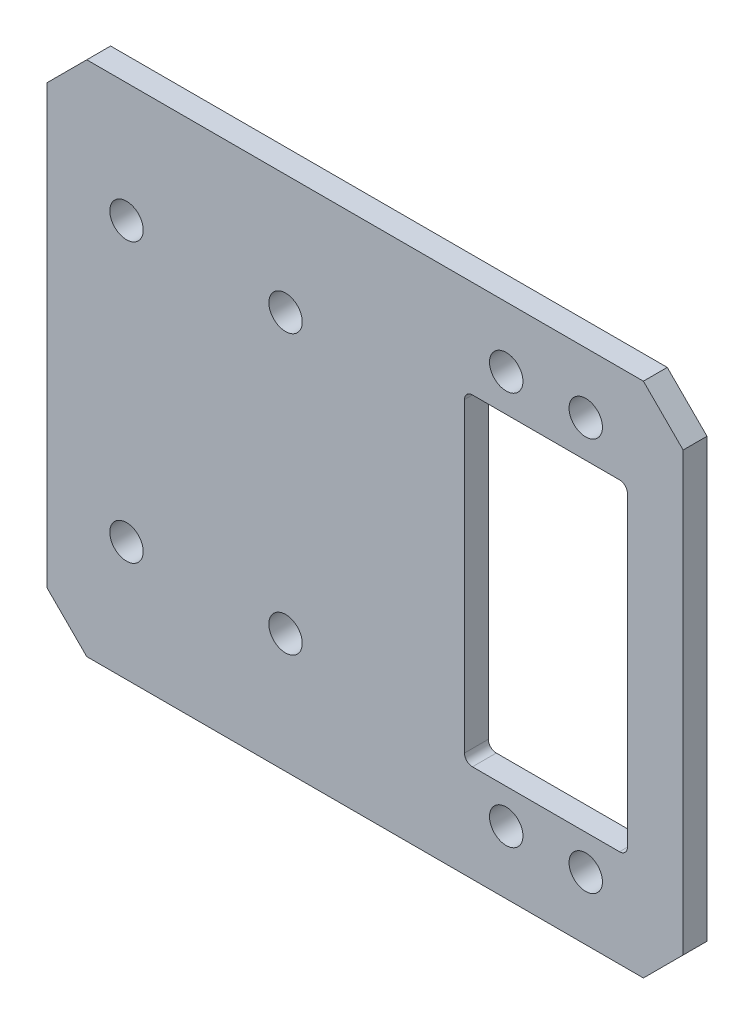
from build123d import *

# Parameters (mm, degrees)
SKETCH_1_W                  = 80
SKETCH_1_H                  = 65
EXTRUDE_1_DEPTH             = 3
SKETCH_2_R                  = 2.1
CUT_EXTRUDE_1_DEPTH         = 52.626059311
PATTERN_LINEAR_1_COUNT      = 2
PATTERN_LINEAR_1_PITCH      = 20
PATTERN_LINEAR_1_COUNT_DIR2 = 2
PATTERN_LINEAR_1_PITCH_DIR2 = 35
SKETCH_4_W                  = 20.5
SKETCH_4_H                  = 40.5
CUT_EXTRUDE_2_DEPTH         = 3
FILLET_1_R                  = 1
CUT_EXTRUDE_3_REACH         = 53.626
SKETCH_5_R                  = 2.1
CHAMFER_3_SIZE              = 5


with BuildPart() as part:
    # 草圖1 → 填料-伸長1 (new body)
    with BuildSketch(Plane.XY):
        Rectangle(SKETCH_1_W, SKETCH_1_H)
    extrude(amount=EXTRUDE_1_DEPTH)

    # 草圖2 → 除料-伸長1 (cut, through all)
    with BuildSketch(Plane.XY.offset(3)):
        with Locations((-30, 17.5)):
            Circle(SKETCH_2_R)
    cut_extrude_1 = extrude(amount=-CUT_EXTRUDE_1_DEPTH, mode=Mode.SUBTRACT)

    # 直線複製排列1: Cut-Extrude 1 2 × 2
    with Locations(*[(i * PATTERN_LINEAR_1_PITCH, -j * PATTERN_LINEAR_1_PITCH_DIR2, 0) for i in range(PATTERN_LINEAR_1_COUNT) for j in range(PATTERN_LINEAR_1_COUNT_DIR2) if (i, j) != (0, 0)]):
        add(cut_extrude_1, mode=Mode.SUBTRACT)

    # 草圖4 → 除料-伸長2 (cut)
    with BuildSketch(Plane.XY.offset(3)):
        with Locations((22.75, 0)):
            Rectangle(SKETCH_4_W, SKETCH_4_H)
    extrude(amount=-CUT_EXTRUDE_2_DEPTH, mode=Mode.SUBTRACT)

    # 圓角1
    fillet_1_edges = [part.edges().sort_by_distance(p)[0] for p in [
        (33, 20.25, 1.5),
        (33, -20.25, 1.5),
        (12.5, -20.25, 1.5),
        (12.5, 20.25, 1.5),
    ]]
    fillet(fillet_1_edges, radius=FILLET_1_R)

    # 草圖5 → 除料-伸長3 (cut, up to next)
    with BuildSketch(Plane.XY.offset(3), mode=Mode.PRIVATE) as cut_extrude_3_sk1:
        with Locations((17.75, 24.9)):
            Circle(SKETCH_5_R)
    cut_extrude_3_tool1 = extrude(cut_extrude_3_sk1.sketch, amount=-CUT_EXTRUDE_3_REACH, mode=Mode.PRIVATE) & part.part
    # 草圖5 → 除料-伸長3 (cut, up to next)
    with BuildSketch(Plane.XY.offset(3), mode=Mode.PRIVATE) as cut_extrude_3_sk2:
        with Locations((27.75, 24.9)):
            Circle(SKETCH_5_R)
    cut_extrude_3_tool2 = extrude(cut_extrude_3_sk2.sketch, amount=-CUT_EXTRUDE_3_REACH, mode=Mode.PRIVATE) & part.part
    # 草圖5 → 除料-伸長3 (cut, up to next)
    with BuildSketch(Plane.XY.offset(3), mode=Mode.PRIVATE) as cut_extrude_3_sk3:
        with Locations((27.75, -24.6)):
            Circle(SKETCH_5_R)
    cut_extrude_3_tool3 = extrude(cut_extrude_3_sk3.sketch, amount=-CUT_EXTRUDE_3_REACH, mode=Mode.PRIVATE) & part.part
    # 草圖5 → 除料-伸長3 (cut, up to next)
    with BuildSketch(Plane.XY.offset(3), mode=Mode.PRIVATE) as cut_extrude_3_sk4:
        with Locations((17.75, -24.6)):
            Circle(SKETCH_5_R)
    cut_extrude_3_tool4 = extrude(cut_extrude_3_sk4.sketch, amount=-CUT_EXTRUDE_3_REACH, mode=Mode.PRIVATE) & part.part
    add(cut_extrude_3_tool1.solids().sort_by_distance((17.75, 24.9, 3))[0], mode=Mode.SUBTRACT)
    add(cut_extrude_3_tool2.solids().sort_by_distance((27.75, 24.9, 3))[0], mode=Mode.SUBTRACT)
    add(cut_extrude_3_tool3.solids().sort_by_distance((27.75, -24.6, 3))[0], mode=Mode.SUBTRACT)
    add(cut_extrude_3_tool4.solids().sort_by_distance((17.75, -24.6, 3))[0], mode=Mode.SUBTRACT)

    # 導角3
    chamfer_3_edges = [part.edges().sort_by_distance(p)[0] for p in [
        (-40, 32.5, 1.5),
        (40, 32.5, 1.5),
        (40, -32.5, 1.5),
        (-40, -32.5, 1.5),
    ]]
    chamfer(chamfer_3_edges, length=CHAMFER_3_SIZE)


solid = part.part
